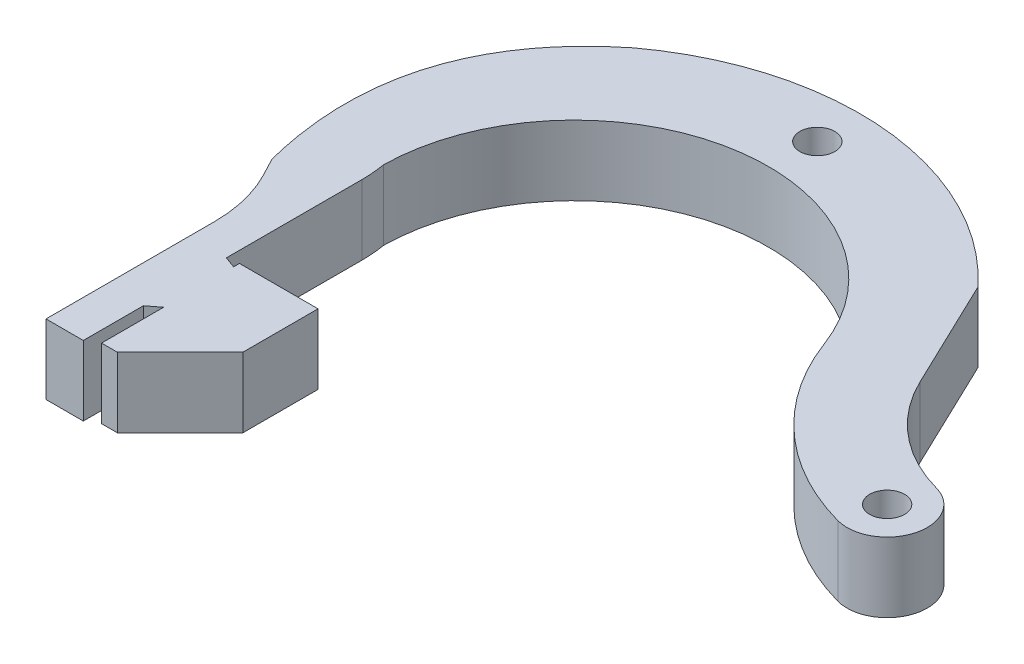
from build123d import *

# Parameters (mm, degrees)
SKETCH2_R           = 2.5
BOSS_EXTRUDE1_DEPTH = 10
BOSS_EXTRUDE2_DEPTH = 10


with BuildPart() as part:
    # Sketch2 → Boss-Extrude1 (new body)
    with BuildSketch(Plane(origin=(0, 0, 0), x_dir=(1, 0, 0), z_dir=(0, 1, 0))):
        with BuildLine():
            Line((-33.226342232, -9.981880582), (-27.883647244, -9.981880582))
            Line((-27.883647244, -9.981880582), (-27.883647244, 29.925281779))
            ThreePointArc((-27.883647244, 29.925281779), (-27.956490633, 31.630693582), (-28.174490185, 33.323682587))
            ThreePointArc((-28.174490185, 33.323682587), (-5.126582747, 60.257622762), (25.614975975, 42.605434852))
            ThreePointArc((25.614975975, 42.605434852), (34.529334698, 29.401291822), (48.478573237, 21.70493367))
            ThreePointArc((48.478573237, 21.70493367), (55.54506633, 25.728573237), (51.521426763, 32.79506633))
            ThreePointArc((51.521426763, 32.79506633), (43.044695487, 37.228328186), (37.173927096, 44.781000713))
            Line((37.173927096, 44.781000713), (29.544453309, 60.710630122))
            ThreePointArc((29.544453309, 60.710630122), (3.323171133, 73.595527675), (-24.801894282, 65.686234454))
            add(Edge.make_bspline(
                [(-36.866842145, 26.021473673), (-43.224794525, 50.957582374), (-24.801894282, 65.686234454)],
                knots=[0, 0, 0, 1, 1, 1], degree=2))
            Line((-36.866842145, 26.021473673), (-35.540312543, 23.509134839))
            ThreePointArc((-35.540312543, 23.509134839), (-33.813452265, 18.981182225), (-33.226342232, 14.170807697))
            Line((-33.226342232, 14.170807697), (-33.226342232, -9.981880582))
        make_face()
        with Locations(Location((0, 67.25, 0), (0, 0, 270))):
            Circle(SKETCH2_R, mode=Mode.SUBTRACT)
        with Locations(Location((50, 27.25, 0), (0, 0, 270))):
            Circle(SKETCH2_R, mode=Mode.SUBTRACT)
    extrude(amount=BOSS_EXTRUDE1_DEPTH)

    # Sketch1 → Boss-Extrude2 (add)
    with BuildSketch(Plane(origin=(0, 0, 0), x_dir=(1, 0, 0), z_dir=(0, 1, 0))):
        Polygon((-26.25, 10.75), (-15, 10.75), (-15, 0), (-23.984756923, -9), (-26.25, -9), (-26.25, -0.114272299), (-29.438415679, -2.555067389), (-29.438415679, 11.073293435), (-26.25, 9.911985917), align=None)
    extrude(amount=BOSS_EXTRUDE2_DEPTH)


solid = part.part
